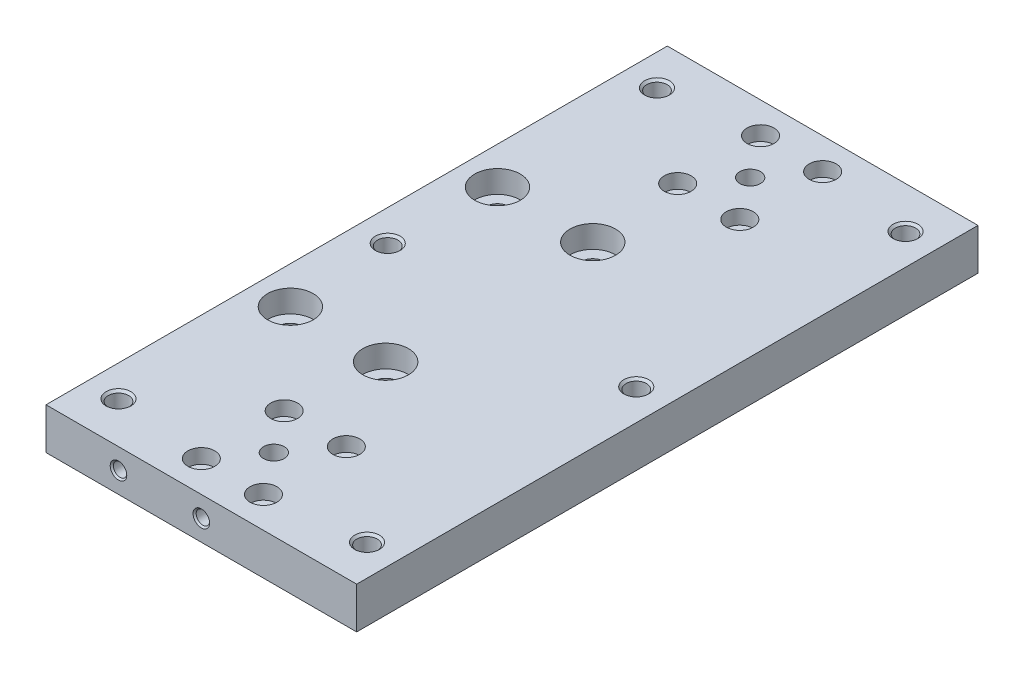
from build123d import *

# Parameters (mm, degrees)
EXTRUDE_1_DEPTH             = 75
EXTRUDE_1_DEPTH_BACK        = 75
SKETCH_1_W                  = 75
SKETCH_1_H                  = 10
SKETCH_2_W                  = 2.5
SKETCH_2_H                  = 10
SKETCH_3_W                  = 2.5
SKETCH_3_H                  = 10
PATTERN_LINEAR_2_COUNT      = 2
PATTERN_LINEAR_2_PITCH      = 23
PATTERN_LINEAR_2_COUNT_DIR2 = 2
PATTERN_LINEAR_2_PITCH_DIR2 = 50
SKETCH_15_W                 = 39
SKETCH_15_H                 = 65
CUT_EXTRUDE_1_DEPTH         = 32.5


with BuildPart() as part:
    # 草图1 → 凸台-拉伸1 (new, two sides: drawn at the far end of the back side and taken through both)
    with BuildSketch(Plane.XY.offset(-EXTRUDE_1_DEPTH_BACK)):
        with Locations((0, 5)):
            Rectangle(SKETCH_1_W, SKETCH_1_H)
    extrude(amount=EXTRUDE_1_DEPTH + EXTRUDE_1_DEPTH_BACK)

    # 草图2 → 切除-旋转1 (revolve, cut)
    with BuildSketch(Plane.XY.offset(57.5)):
        with Locations((-1.25, 5)):
            Rectangle(SKETCH_2_W, SKETCH_2_H)
    revolve(axis=Axis((0, 10, 57.5), (0, -1, 0)), mode=Mode.SUBTRACT)

    # 草图3 → 切除-旋转2 (revolve, cut)
    with BuildSketch(Plane.XY.offset(-57.5)):
        with Locations((-1.25, 5)):
            Rectangle(SKETCH_3_W, SKETCH_3_H)
    revolve(axis=Axis((0, 10, -57.5), (0, -1, 0)), mode=Mode.SUBTRACT)

    # 草图4 → 切除-旋转3 (revolve, cut)
    with BuildSketch(Plane.XY.offset(67.5)):
        Polygon((-7.5, 0), (-9.25, 0), (-9.25, 6.5), (-10.75, 6.5), (-10.75, 10), (-7.5, 10), align=None)
    revolve(axis=Axis((-7.5, 10, 67.5), (0, -1, 0)), mode=Mode.SUBTRACT)

    # 草图6 → 切除-旋转4 (revolve, cut)
    with BuildSketch(Plane.XY.offset(-47.5)):
        Polygon((7.5, 0), (5.75, 0), (5.75, 6.5), (4.25, 6.5), (4.25, 10), (7.5, 10), align=None)
    revolve(axis=Axis((7.5, 10, -47.5), (0, -1, 0)), mode=Mode.SUBTRACT)

    # 草图7 → 切除-旋转5 (revolve, cut)
    with BuildSketch(Plane.XY.offset(-47.5)):
        Polygon((-7.5, 0), (-9.25, 0), (-9.25, 6.5), (-10.75, 6.5), (-10.75, 10), (-7.5, 10), align=None)
    revolve(axis=Axis((-7.5, 10, -47.5), (0, -1, 0)), mode=Mode.SUBTRACT)

    # 草图8 → 切除-旋转6 (revolve, cut)
    with BuildSketch(Plane.XY.offset(-67.5)):
        Polygon((7.5, 0), (5.75, 0), (5.75, 6.5), (4.25, 6.5), (4.25, 10), (7.5, 10), align=None)
    revolve(axis=Axis((7.5, 10, -67.5), (0, -1, 0)), mode=Mode.SUBTRACT)

    # 草图9 → 切除-旋转7 (revolve, cut)
    with BuildSketch(Plane.XY.offset(-67.5)):
        Polygon((-7.5, 0), (-9.25, 0), (-9.25, 6.5), (-10.75, 6.5), (-10.75, 10), (-7.5, 10), align=None)
    revolve(axis=Axis((-7.5, 10, -67.5), (0, -1, 0)), mode=Mode.SUBTRACT)

    # 草图10 → 切除-旋转8 (revolve, cut)
    with BuildSketch(Plane.XY.offset(47.5)):
        Polygon((7.5, 0), (5.75, 0), (5.75, 6.5), (4.25, 6.5), (4.25, 10), (7.5, 10), align=None)
    revolve(axis=Axis((7.5, 10, 47.5), (0, -1, 0)), mode=Mode.SUBTRACT)

    # 草图11 → 切除-旋转9 (revolve, cut)
    with BuildSketch(Plane.XY.offset(47.5)):
        Polygon((-7.5, 0), (-9.25, 0), (-9.25, 6.5), (-10.75, 6.5), (-10.75, 10), (-7.5, 10), align=None)
    revolve(axis=Axis((-7.5, 10, 47.5), (0, -1, 0)), mode=Mode.SUBTRACT)

    # 草图12 → 切除-旋转10 (revolve, cut)
    with BuildSketch(Plane.XY.offset(67.5)):
        Polygon((7.5, 0), (5.75, 0), (5.75, 6.5), (4.25, 6.5), (4.25, 10), (7.5, 10), align=None)
    revolve(axis=Axis((7.5, 10, 67.5), (0, -1, 0)), mode=Mode.SUBTRACT)

    # 草图13 → 切除-旋转11 (revolve, cut)
    with BuildSketch(Plane(origin=(-28.5, 0, 0), x_dir=(0, 0, -1), z_dir=(1, 0, 0))):
        Polygon((-25, 0), (-27.75, 0), (-27.75, 4.6), (-30.5, 4.6), (-30.5, 10), (-25, 10), align=None)
    cut_revolve_11 = revolve(axis=Axis((-28.5, 10, 25), (0, -1, 0)), mode=Mode.SUBTRACT)

    # 阵列(线性)2: Cut-Revolve 11 2 × 2
    with Locations(*[(i * PATTERN_LINEAR_2_PITCH, 0, -j * PATTERN_LINEAR_2_PITCH_DIR2) for i in range(PATTERN_LINEAR_2_COUNT) for j in range(PATTERN_LINEAR_2_COUNT_DIR2) if (i, j) != (0, 0)]):
        add(cut_revolve_11, mode=Mode.SUBTRACT)

    # 草图15 → 切除-拉伸1 (cut)
    with BuildSketch(Plane(origin=(0, 2.5, 0), x_dir=(1, 0, 0), z_dir=(0, 1, 0))):
        with Locations((-17, 0)):
            Rectangle(SKETCH_15_W, SKETCH_15_H)
    extrude(amount=-CUT_EXTRUDE_1_DEPTH, mode=Mode.SUBTRACT)

    # 草图16 → 切除-旋转12 (revolve, cut)
    with BuildSketch(Plane(origin=(0, 0, 0), x_dir=(0, 0, -1), z_dir=(1, 0, 0))):
        Polygon((-75, 5), (-75, 7), (-74.621, 6.621), (-65.4, 6.621), (-64.464115214, 5), align=None)
    revolve(axis=Axis((0, 5, 64.464115214), (0, 0, 1)), mode=Mode.SUBTRACT)

    # 草图17 → 切除-旋转13 (revolve, cut)
    with BuildSketch(Plane(origin=(0, 0, 0), x_dir=(0, 0, -1), z_dir=(1, 0, 0))):
        Polygon((75, 5), (75, 3), (74.621, 3.379), (65.4, 3.379), (64.464115214, 5), align=None)
    revolve(axis=Axis((0, 5, -64.464115214), (0, 0, -1)), mode=Mode.SUBTRACT)

    # 草图18 → 切除-旋转14 (revolve, cut)
    with BuildSketch(Plane(origin=(-20, 0, 0), x_dir=(0, 0, -1), z_dir=(1, 0, 0))):
        Polygon((-75, 5), (-75, 7), (-74.621, 6.621), (-65.4, 6.621), (-64.464115214, 5), align=None)
    revolve(axis=Axis((-20, 5, 64.464115214), (0, 0, 1)), mode=Mode.SUBTRACT)

    # 草图19 → 切除-旋转15 (revolve, cut)
    with BuildSketch(Plane(origin=(-20, 0, 0), x_dir=(0, 0, -1), z_dir=(1, 0, 0))):
        Polygon((75, 5), (75, 3), (74.621, 3.379), (65.4, 3.379), (64.464115214, 5), align=None)
    revolve(axis=Axis((-20, 5, -64.464115214), (0, 0, -1)), mode=Mode.SUBTRACT)

    # 草图20 → 切除-旋转16 (revolve, cut)
    with BuildSketch(Plane(origin=(30, 0, 0), x_dir=(0, 0, -1), z_dir=(1, 0, 0))):
        Polygon((-65, 10), (-62, 10), (-62.5415, 9.4585), (-62.5415, 0.5415), (-62, 0), (-65, 0), align=None)
    revolve(axis=Axis((30, 0, 65), (0, 1, 0)), mode=Mode.SUBTRACT)

    # 草图21 → 切除-旋转17 (revolve, cut)
    with BuildSketch(Plane(origin=(30, 0, 0), x_dir=(0, 0, -1), z_dir=(1, 0, 0))):
        Polygon((65, 10), (68, 10), (67.4585, 9.4585), (67.4585, 0.5415), (68, 0), (65, 0), align=None)
    revolve(axis=Axis((30, 0, -65), (0, 1, 0)), mode=Mode.SUBTRACT)

    # 草图22 → 切除-旋转18 (revolve, cut)
    with BuildSketch(Plane(origin=(30, 0, 0), x_dir=(0, 0, -1), z_dir=(1, 0, 0))):
        Polygon((0, 10), (3, 10), (2.4585, 9.4585), (2.4585, 0.5415), (3, 0), (0, 0), align=None)
    revolve(axis=Axis((30, 0, 0), (0, 1, 0)), mode=Mode.SUBTRACT)

    # 草图23 → 切除-旋转19 (revolve, cut)
    with BuildSketch(Plane(origin=(-30, 0, 0), x_dir=(0, 0, -1), z_dir=(1, 0, 0))):
        Polygon((-65, 10), (-62, 10), (-62.5415, 9.4585), (-62.5415, 0.5415), (-62, 0), (-65, 0), align=None)
    revolve(axis=Axis((-30, 0, 65), (0, 1, 0)), mode=Mode.SUBTRACT)

    # 草图24 → 切除-旋转20 (revolve, cut)
    with BuildSketch(Plane(origin=(-30, 0, 0), x_dir=(0, 0, -1), z_dir=(1, 0, 0))):
        Polygon((65, 10), (68, 10), (67.4585, 9.4585), (67.4585, 0.5415), (68, 0), (65, 0), align=None)
    revolve(axis=Axis((-30, 0, -65), (0, 1, 0)), mode=Mode.SUBTRACT)

    # 草图25 → 切除-旋转21 (revolve, cut)
    with BuildSketch(Plane(origin=(-30, 0, 0), x_dir=(0, 0, -1), z_dir=(1, 0, 0))):
        Polygon((0, 10), (3, 10), (2.4585, 9.4585), (2.4585, 3.0415), (3, 2.5), (0, 2.5), align=None)
    revolve(axis=Axis((-30, 2.5, 0), (0, 1, 0)), mode=Mode.SUBTRACT)


solid = part.part
